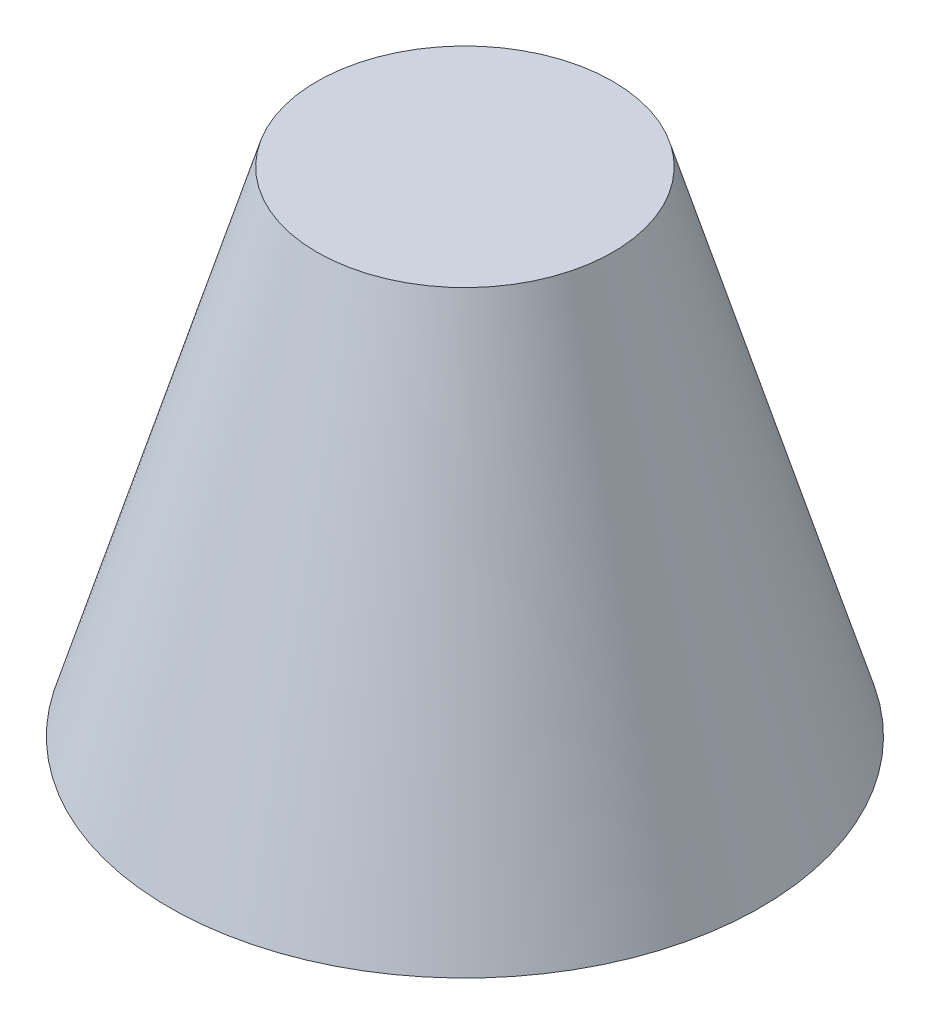
from build123d import *


with BuildPart() as part:
    # 草图1 → 旋转1 (revolve)
    with BuildSketch(Plane.XY, mode=Mode.PRIVATE) as revolve_1_sk:
        Polygon((0, 0), (0, 25), (-7.5, 25), (-15, 0), align=None)
    revolve(revolve_1_sk.sketch.rotate(Axis((0, 0, 0), (0, 1, 0)), 270), axis=Axis((0, 0, 0), (0, 1, 0)))


solid = part.part
